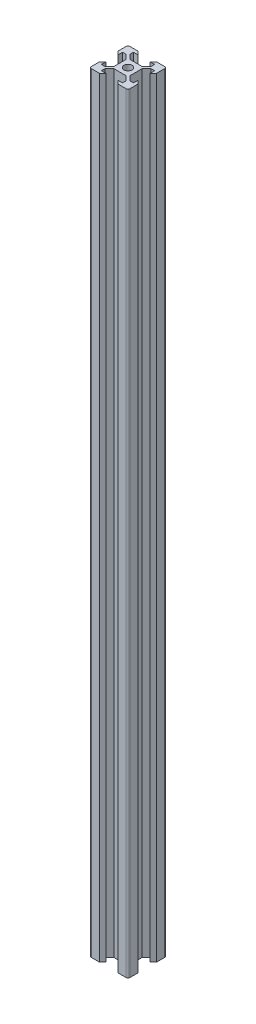
from build123d import *

# Parameters (mm, degrees)
MASTERLAYOUTSKETCH_R  = 2.1
MAIN_EXTRUSION_DEPTH  = 400
EDGE_FILLETS_R        = 1
M5_TAPPED_HOLE1_D     = 4.2
M5_TAPPED_HOLE1_DEPTH = 12.4
M5_TAPPED_HOLE1_TIP   = 1.2618073


with BuildPart() as part:
    # MasterLayoutSketch → Main Extrusion (new body)
    with BuildSketch(Plane(origin=(0, 0, 0), x_dir=(1, 0, 0), z_dir=(0, 1, 0))):
        Polygon((-8.325, 3.1), (-8.325, 5.5), (-6.560660172, 5.5), (-4.160660172, 3.1), (-4.160660172, -3.1), (-6.560660172, -5.5), (-8.325, -5.5), (-8.325, -3.1), (-10, -4.775), (-10, -10), (-4.775, -10), (-3.1, -8.325), (-5.5, -8.325), (-5.5, -6.560660172), (-3.1, -4.160660172), (3.1, -4.160660172), (5.5, -6.560660172), (5.5, -8.325), (3.1, -8.325), (4.775, -10), (10, -10), (10, -4.775), (8.325, -3.1), (8.325, -5.5), (6.560660172, -5.5), (4.160660172, -3.1), (4.160660172, 3.1), (6.560660172, 5.5), (8.325, 5.5), (8.325, 3.1), (10, 4.775), (10, 10), (4.775, 10), (3.1, 8.325), (5.5, 8.325), (5.5, 6.560660172), (3.1, 4.160660172), (-3.1, 4.160660172), (-5.5, 6.560660172), (-5.5, 8.325), (-3.1, 8.325), (-4.775, 10), (-10, 10), (-10, 4.775), align=None)
        with Locations(Location((0, 0, 0), (0, 0, 270))):
            Circle(MASTERLAYOUTSKETCH_R, mode=Mode.SUBTRACT)
    extrude(amount=MAIN_EXTRUSION_DEPTH)

    # Edge Fillets
    edge_fillets_edges = [part.edges().sort_by_distance(p)[0] for p in [
        (10, 200, -10),
        (10, 200, 10),
        (-10, 200, 10),
        (-10, 200, -10),
    ]]
    fillet(edge_fillets_edges, radius=EDGE_FILLETS_R)

    # M5 Tapped Hole1
    with Locations(Plane(origin=(0, 0, 0), x_dir=(-1, 0, 0), z_dir=(0, -1, 0))):
        with Locations((0, 0)):
            Hole(M5_TAPPED_HOLE1_D / 2, depth=M5_TAPPED_HOLE1_DEPTH)
            with Locations((0, 0, -(M5_TAPPED_HOLE1_DEPTH + M5_TAPPED_HOLE1_TIP / 2))):  # 118° drill point
                Cone(0, M5_TAPPED_HOLE1_D / 2, M5_TAPPED_HOLE1_TIP, mode=Mode.SUBTRACT)


solid = part.part
